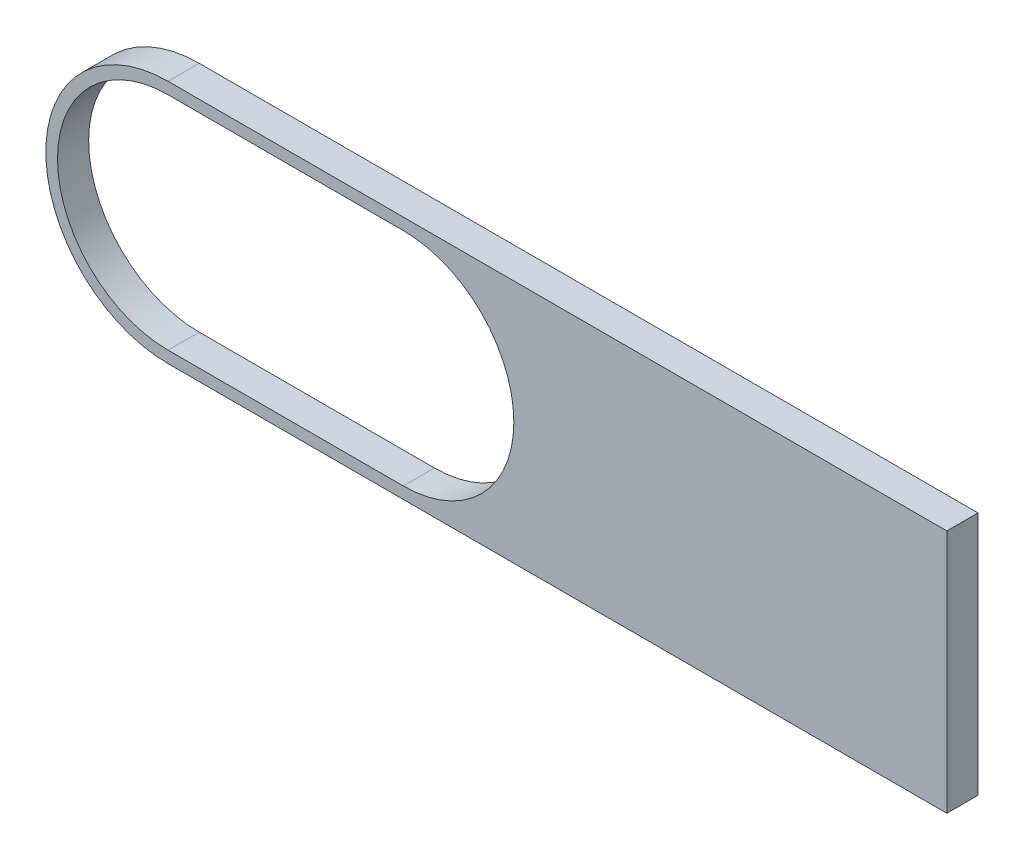
from build123d import *

# Parameters (mm, degrees)
SKETCH1_R               = 19.939
CIRCLE_EXTRUDE_DEPTH    = 5.08
SKETCH3_W               = 5.08
SKETCH3_H               = 39.878
RECTANGLE_EXTRUDE_DEPTH = 127
SKETCH2_R               = 18.034
CIRCLE_CUT_DEPTH        = 129.65601471
SKETCH6_W               = 125.095
SKETCH6_H               = 36.068
RECTANGLE_CUT_DEPTH     = 129.65601471
END_SHAPE_DEPTH         = 5.08


with BuildPart() as part:
    # Sketch1 → circle extrude (new body)
    with BuildSketch(Plane.XY):
        Circle(SKETCH1_R)
    extrude(amount=CIRCLE_EXTRUDE_DEPTH)

    # Sketch3 → rectangle extrude (add)
    with BuildSketch(Plane(origin=(0, 0, 0), x_dir=(0, 0, -1), z_dir=(1, 0, 0))):
        with Locations((-2.54, 0)):
            Rectangle(SKETCH3_W, SKETCH3_H)
    extrude(amount=RECTANGLE_EXTRUDE_DEPTH)

    # Sketch2 → circle cut (cut, through all)
    with BuildSketch(Plane.XY.offset(5.08)):
        Circle(SKETCH2_R)
    extrude(amount=-CIRCLE_CUT_DEPTH, mode=Mode.SUBTRACT)

    # Sketch6 → rectangle cut (cut, through all)
    with BuildSketch(Plane.XY.offset(5.08)):
        with Locations((62.5475, 0)):
            Rectangle(SKETCH6_W, SKETCH6_H)
    extrude(amount=-RECTANGLE_CUT_DEPTH, mode=Mode.SUBTRACT)

    # Sketch7 → end shape (add)
    with BuildSketch(Plane.XY.offset(5.08)):
        with BuildLine():
            Line((38.354, 18.034), (125.095, 18.034))
            Line((125.095, 18.034), (125.095, -18.034))
            Line((125.095, -18.034), (38.354, -18.034))
            ThreePointArc((38.354, -18.034), (56.388, 0), (38.354, 18.034))
        make_face()
    extrude(amount=-END_SHAPE_DEPTH)


solid = part.part
